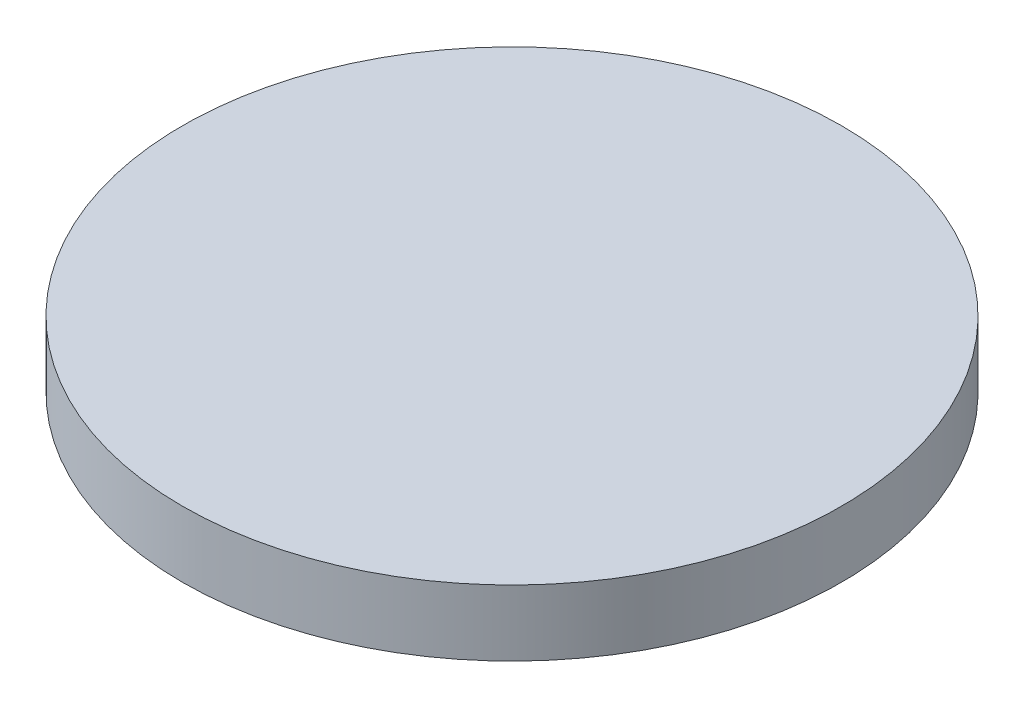
from build123d import *

# Parameters (mm, degrees)
BOSS_EXTRUDE1_DEPTH      = 3.175
BOSS_EXTRUDE1_DEPTH_BACK = 3.175
SKETCH3_R                = 31.75


with BuildPart() as part:
    # Sketch3 → Boss-Extrude1 (new, two sides: drawn at the far end of the back side and taken through both)
    with BuildSketch(Plane(origin=(0, 0, 0), x_dir=(1, 0, 0), z_dir=(0, 1, 0)).offset(-BOSS_EXTRUDE1_DEPTH_BACK)):
        with Locations(Location((0, 0, 0), (0, 0, 270))):
            Circle(SKETCH3_R)
    extrude(amount=BOSS_EXTRUDE1_DEPTH + BOSS_EXTRUDE1_DEPTH_BACK)


solid = part.part
